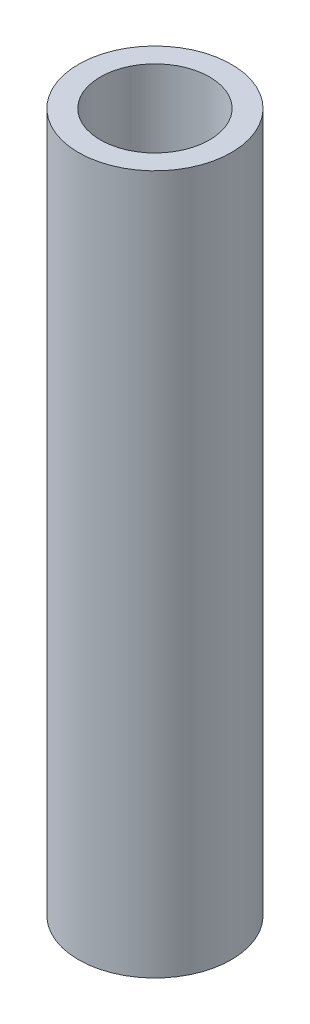
from build123d import *

# Parameters (mm, degrees)
SKETCH1_R           = 3.5
BOSS_EXTRUDE1_DEPTH = 32
SKETCH2_R           = 2.5
CUT_EXTRUDE1_DEPTH  = 32


with BuildPart() as part:
    # Sketch1 → Boss-Extrude1 (new body)
    with BuildSketch(Plane(origin=(0, 0, 0), x_dir=(1, 0, 0), z_dir=(0, 1, 0))):
        with Locations(Location((0, 0, 0), (0, 0, 270))):
            Circle(SKETCH1_R)
    extrude(amount=BOSS_EXTRUDE1_DEPTH)

    # Sketch2 → Cut-Extrude1 (cut)
    with BuildSketch(Plane.XZ):
        with Locations(Location((0, 0, 0), (0, 0, 270))):
            Circle(SKETCH2_R)
    extrude(amount=-CUT_EXTRUDE1_DEPTH, mode=Mode.SUBTRACT)


solid = part.part
